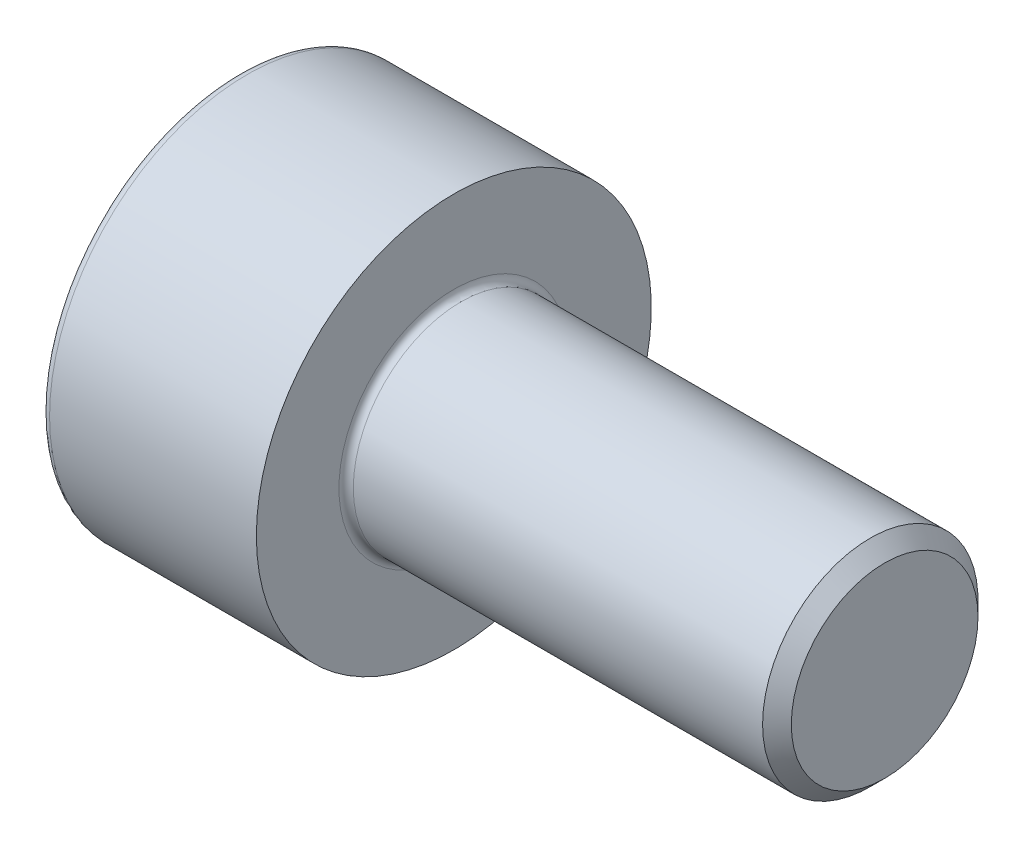
from build123d import *

# Parameters (mm, degrees)
FILLET1_R      = 0.1
FILLET2_R      = 0.12
CHAMFER1_SIZE  = 0.2
EXTRUDE1_DEPTH = 1


with BuildPart() as part:
    # Sketch1 → Revolve1 (revolve)
    with BuildSketch(Plane.XY, mode=Mode.PRIVATE) as revolve1_sk:
        Polygon((3, 1.5), (3, 0), (4.279914881, 0), (9, 0), (9, 1.5), align=None)
        Polygon((0, 2.75), (0, 0), (3, 0), (3, 1.5), (3, 2.75), align=None)
    revolve(revolve1_sk.sketch.rotate(Axis((0, 0, 0), (1, 0, 0)), 90), axis=Axis((0, 0, 0), (1, 0, 0)))

    # Fillet1
    fillet1_edges = [part.edges().sort_by_distance(p)[0] for p in [
        (3, 0, -1.5),
    ]]
    fillet(fillet1_edges, radius=FILLET1_R)

    # Fillet2
    fillet2_edges = [part.edges().sort_by_distance(p)[0] for p in [
        (0, 0, -2.75),
    ]]
    fillet(fillet2_edges, radius=FILLET2_R)

    # Chamfer1
    chamfer1_edges = [part.edges().sort_by_distance(p)[0] for p in [
        (9, 0, -1.5),
    ]]
    chamfer(chamfer1_edges, length=CHAMFER1_SIZE)

    # Sketch2 → Extrude1 (cut)
    with BuildSketch(Plane.ZY):
        Polygon((0, 1.443375673), (-1.25, 0.721687836), (-1.25, -0.721687836), (0, -1.443375673), (1.25, -0.721687836), (1.25, 0.721687836), align=None)
    extrude(amount=-EXTRUDE1_DEPTH, mode=Mode.SUBTRACT)


solid = part.part
